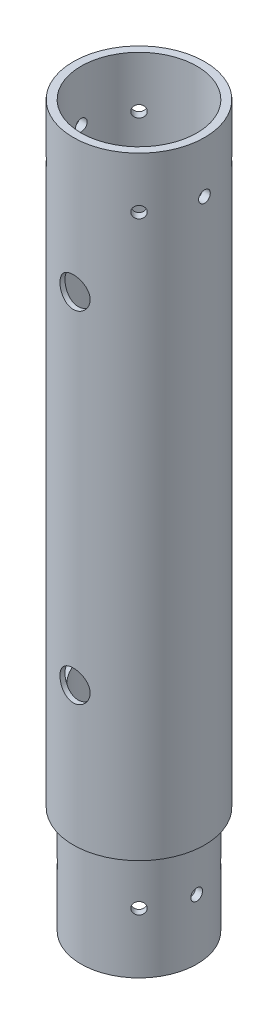
from build123d import *

# Parameters (mm, degrees)
SKETCH_1_R             = 135
SKETCH_1_R_2           = 125
EXTRUDE_1_DEPTH        = 1039
EXTRUDE_START          = 220
SKETCH_10_R            = 135
SKETCH_10_R_2          = 105
EXTRUDE_2_DEPTH        = 220
SKETCH_11_R            = 119
SKETCH_11_R_2          = 105
EXTRUDE_3_DEPTH        = 220
EXTRUDE_START_2        = -220
SKETCH_12_R            = 125
SKETCH_12_R_2          = 119
EXTRUDE_4_DEPTH        = 220
SKETCH_4_R             = 31
CUT_EXTRUDE_1_DEPTH    = 1226.14121635
SKETCH_7_R             = 12
CUT_EXTRUDE_3_DEPTH    = 1174.017902831
SKETCH_8_R             = 12
CUT_EXTRUDE_4_DEPTH    = 1174.017902831
SKETCH_9_R             = 12
CUT_EXTRUDE_5_DEPTH    = 1226.141216498
PATTERN_LINEAR_1_COUNT = 2
PATTERN_LINEAR_1_PITCH = 1250


with BuildPart() as part:
    # 草图1 → 凸台-拉伸1 (new body)
    with BuildSketch(Plane(origin=(0, 0, 0), x_dir=(1, 0, 0), z_dir=(0, 1, 0))):
        Circle(SKETCH_1_R)
        Circle(SKETCH_1_R_2, mode=Mode.SUBTRACT)
    extrude(amount=EXTRUDE_1_DEPTH)

    # 草图10 → 凸台-拉伸2 (add)
    with BuildSketch(Plane(origin=(0, 0, 0), x_dir=(-1, 0, 0), z_dir=(0, -1, 0)).offset(EXTRUDE_START)):
        Circle(SKETCH_10_R)
        Circle(SKETCH_10_R_2, mode=Mode.SUBTRACT)
    extrude(amount=-EXTRUDE_2_DEPTH)

    # 草图11 → 凸台-拉伸3 (add)
    with BuildSketch(Plane.XZ.offset(220).offset(EXTRUDE_START)):
        Circle(SKETCH_11_R)
        Circle(SKETCH_11_R_2, mode=Mode.SUBTRACT)
    extrude(amount=-EXTRUDE_3_DEPTH)

    # 草图12 → 凸台-拉伸4 (add)
    with BuildSketch(Plane(origin=(0, 1039, 0), x_dir=(1, 0, 0), z_dir=(0, 1, 0)).offset(EXTRUDE_START_2)):
        Circle(SKETCH_12_R)
        Circle(SKETCH_12_R_2, mode=Mode.SUBTRACT)
    extrude(amount=EXTRUDE_4_DEPTH)

    # 草图4 → 切除-拉伸1 (cut, through all)
    with BuildSketch(Plane.XY.offset(500)):
        with Locations((0, 764)):
            Circle(SKETCH_4_R)
        with Locations((0, 64)):
            Circle(SKETCH_4_R)
    extrude(amount=-CUT_EXTRUDE_1_DEPTH, mode=Mode.SUBTRACT)

    # 草图7 → 切除-拉伸3 (cut, through all)
    with BuildSketch(Plane(origin=(-250, 0, 250), x_dir=(-0.7071067811865476, 0, -0.7071067811865476), z_dir=(0.7071067811865476, 0, -0.7071067811865476))):
        with Locations((0, 934)):
            Circle(SKETCH_7_R)
    cut_extrude_3 = extrude(amount=CUT_EXTRUDE_3_DEPTH, mode=Mode.SUBTRACT)

    # 草图8 → 切除-拉伸4 (cut, through all)
    with BuildSketch(Plane(origin=(250, 0, 250), x_dir=(0.7071067811865476, 0, -0.7071067811865476), z_dir=(0.7071067811865476, 0, 0.7071067811865476))):
        with Locations((0, 934)):
            Circle(SKETCH_8_R)
    cut_extrude_4 = extrude(amount=-CUT_EXTRUDE_4_DEPTH, mode=Mode.SUBTRACT)

    # 草图9 → 切除-拉伸5 (cut, through all)
    with BuildSketch(Plane(origin=(500, 0, 0), x_dir=(0, 0, -1), z_dir=(1, 0, 0))):
        with Locations((0, 934)):
            Circle(SKETCH_9_R)
    cut_extrude_5 = extrude(amount=-CUT_EXTRUDE_5_DEPTH, mode=Mode.SUBTRACT)

    # 阵列(线性)1: 切除-拉伸3, 切除-拉伸4, 切除-拉伸5 ×2
    with Locations(*[(0, -i * PATTERN_LINEAR_1_PITCH, 0) for i in range(1, PATTERN_LINEAR_1_COUNT)]):
        add(cut_extrude_3, mode=Mode.SUBTRACT)
        add(cut_extrude_4, mode=Mode.SUBTRACT)
        add(cut_extrude_5, mode=Mode.SUBTRACT)


solid = part.part
